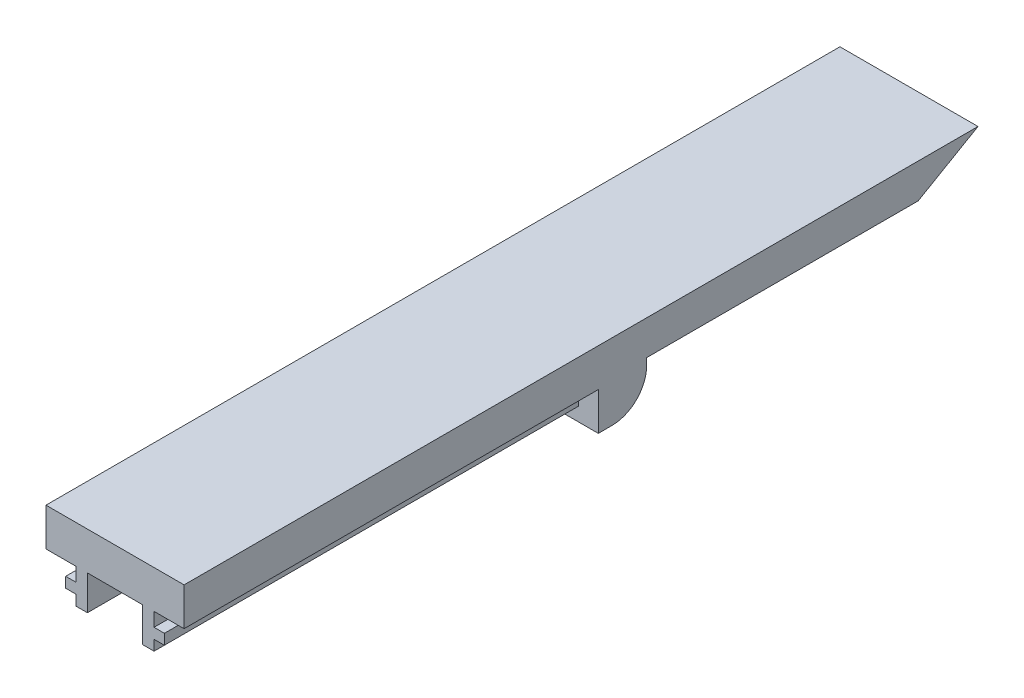
from build123d import *

# Parameters (mm, degrees)
SKETCH1_W           = 20
SKETCH1_H           = 8
BOSS_EXTRUDE1_DEPTH = 115
CUT_EXTRUDE1_DEPTH  = 60
SKETCH3_W           = 20
SKETCH3_H           = 115
BOSS_EXTRUDE2_DEPTH = 3
SKETCH13_W          = 46.736094472
SKETCH13_H          = 63.842099498
CUT_EXTRUDE5_DEPTH  = 30
SKETCH15_W          = 20
SKETCH15_H          = 40
CUT_EXTRUDE6_DEPTH  = 6
FILLET1_R           = 5


with BuildPart() as part:
    # Sketch1 → Boss-Extrude1 (new body)
    with BuildSketch(Plane.XY):
        with Locations((-16.536312849, 6.223463687)):
            Rectangle(SKETCH1_W, SKETCH1_H)
    extrude(amount=-BOSS_EXTRUDE1_DEPTH)

    # Sketch2 → Cut-Extrude1 (cut)
    with BuildSketch(Plane.XY):
        Polygon((-26.536312849, 7.723463687), (-22.186312849, 7.723463687), (-22.186312849, 5.723463687), (-23.686312849, 5.723463687), (-23.686312849, 4.223463687), (-22.186312849, 4.223463687), (-22.186312849, 2.723463687), (-20.536312849, 2.723463687), (-20.536312849, 7.723463687), (-12.536312849, 7.723463687), (-12.536312849, 2.723463687), (-10.886312849, 2.723463687), (-10.886312849, 4.223463687), (-9.386312849, 4.223463687), (-9.386312849, 5.723463687), (-10.886312849, 5.723463687), (-10.886312849, 7.723463687), (-6.536312849, 7.723463687), (-6.536312849, 2.223463687), (-26.536312849, 2.223463687), align=None)
    extrude(amount=-CUT_EXTRUDE1_DEPTH, mode=Mode.SUBTRACT)

    # Sketch3 → Boss-Extrude2 (add)
    with BuildSketch(Plane(origin=(0, 10.223463687, 0), x_dir=(1, 0, 0), z_dir=(0, 1, 0))):
        with Locations((-16.536312849, 57.5)):
            Rectangle(SKETCH3_W, SKETCH3_H)
    extrude(amount=BOSS_EXTRUDE2_DEPTH)

    # Sketch13 → Cut-Extrude5 (cut)
    with BuildSketch(Plane(origin=(0, -39.878862952, -23.02407226), x_dir=(-1, 0, 0), z_dir=(0, 0.866025403784438, 0.500000000000001))):
        with Locations((16.217588554, -100.321082734)):
            Rectangle(SKETCH13_W, SKETCH13_H)
    extrude(amount=-CUT_EXTRUDE5_DEPTH, mode=Mode.SUBTRACT)

    # Sketch15 → Cut-Extrude6 (cut)
    with BuildSketch(Plane.XZ.offset(-2.223463687)):
        with Locations((-16.536312849, -87)):
            Rectangle(SKETCH15_W, SKETCH15_H)
    extrude(amount=-CUT_EXTRUDE6_DEPTH, mode=Mode.SUBTRACT)

    # Fillet1
    fillet1_edges = [part.edges().sort_by_distance(p)[0] for p in [
        (-16.536312849, 2.223463687, -67),
    ]]
    fillet(fillet1_edges, radius=FILLET1_R)


solid = part.part
